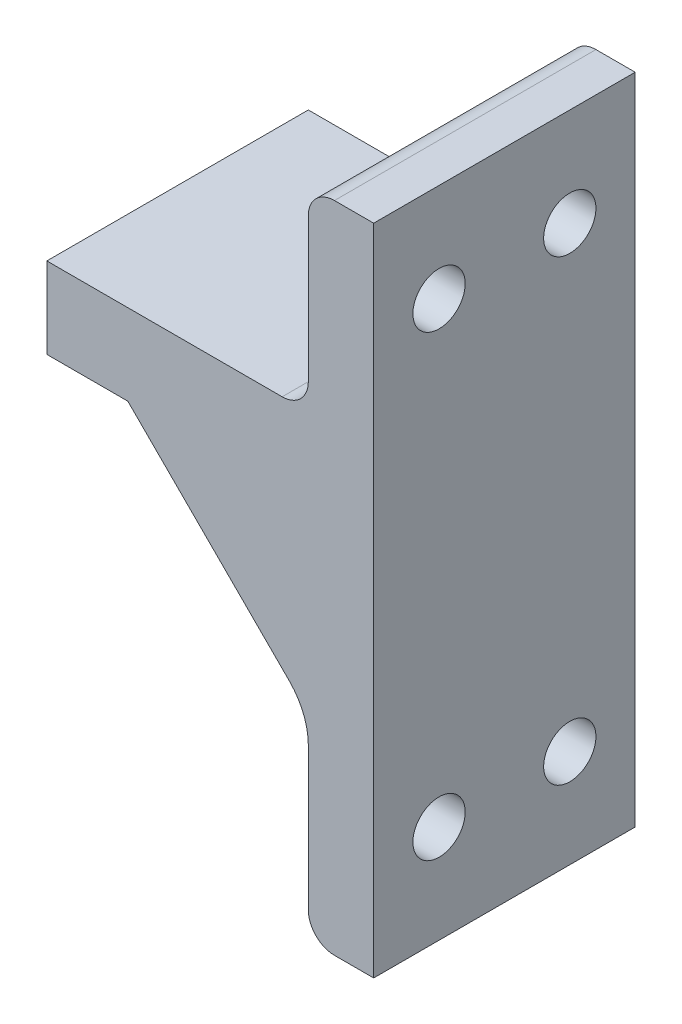
from build123d import *

# Parameters (mm, degrees)
EXTRUDE_1_DEPTH     = 20
SKETCH_2_R          = 2
CUT_EXTRUDE_1_DEPTH = 20
FILLET_1_R          = 2
FILLET_2_R          = 5
SKETCH_3_W          = 6.194211673
SKETCH_3_H          = 6.194211673
EXTRUDE_2_DEPTH     = 20


with BuildPart() as part:
    # 草图1 → 凸台-拉伸1 (new body)
    with BuildSketch(Plane.XY):
        Polygon((0, 0), (0, 50), (-5, 50), (-5, 35), (-25, 35), (-5, 15), (-5, 0), align=None)
    extrude(amount=EXTRUDE_1_DEPTH)

    # 草图2 → 切除-拉伸1 (cut)
    with BuildSketch(Plane.ZY.offset(5)):
        with Locations(Location((5, 42.5, 0), (0, 0, 270))):
            Circle(SKETCH_2_R)
        with Locations(Location((15, 42.5, 0), (0, 0, 270))):
            Circle(SKETCH_2_R)
        with Locations(Location((5, 7.5, 0), (0, 0, 270))):
            Circle(SKETCH_2_R)
        with Locations(Location((15, 7.5, 0), (0, 0, 270))):
            Circle(SKETCH_2_R)
    extrude(amount=-CUT_EXTRUDE_1_DEPTH, mode=Mode.SUBTRACT)

    # 圆角1
    fillet_1_edges = [part.edges().sort_by_distance(p)[0] for p in [
        (-5, 0, 10),
        (-5, 35, 10),
        (-5, 50, 10),
    ]]
    fillet(fillet_1_edges, radius=FILLET_1_R)

    # 圆角2
    fillet_2_edges = [part.edges().sort_by_distance(p)[0] for p in [
        (-5, 15, 10),
    ]]
    fillet(fillet_2_edges, radius=FILLET_2_R)

    # 草图3 → 凸台-拉伸2 (add, through all)
    with BuildSketch(Plane(origin=(0, 0, 0), x_dir=(-1, 0, 0), z_dir=(0, 0, -1))):
        with Locations((21.902894164, 31.902894164)):
            Rectangle(SKETCH_3_W, SKETCH_3_H)
    extrude(amount=-EXTRUDE_2_DEPTH)


solid = part.part
